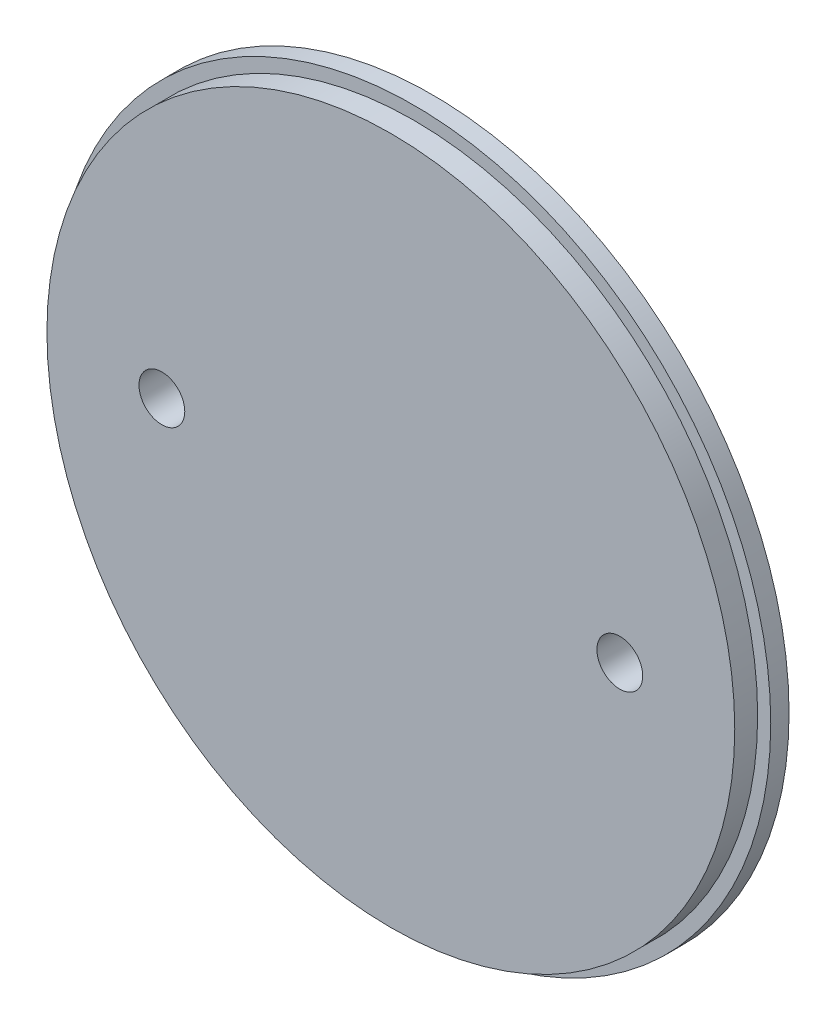
from build123d import *

# Parameters (mm, degrees)
SKETCH1_R           = 49.5046
BOSS_EXTRUDE1_DEPTH = 2.54
SKETCH2_R           = 47.6885
BOSS_EXTRUDE2_DEPTH = 3.175
SKETCH3_R           = 3.175
CUT_EXTRUDE1_DEPTH  = 71.242950303


with BuildPart() as part:
    # Sketch1 → Boss-Extrude1 (new body)
    with BuildSketch(Plane.XY):
        Circle(SKETCH1_R)
    extrude(amount=BOSS_EXTRUDE1_DEPTH)

    # Sketch2 → Boss-Extrude2 (add)
    with BuildSketch(Plane.XY.offset(2.54)):
        Circle(SKETCH2_R)
    extrude(amount=BOSS_EXTRUDE2_DEPTH)

    # Sketch3 → Cut-Extrude1 (cut, through all)
    with BuildSketch(Plane.XY.offset(5.715)):
        with Locations((-31.75, 0)):
            Circle(SKETCH3_R)
        with Locations((31.75, 0)):
            Circle(SKETCH3_R)
    extrude(amount=-CUT_EXTRUDE1_DEPTH, mode=Mode.SUBTRACT)


solid = part.part
